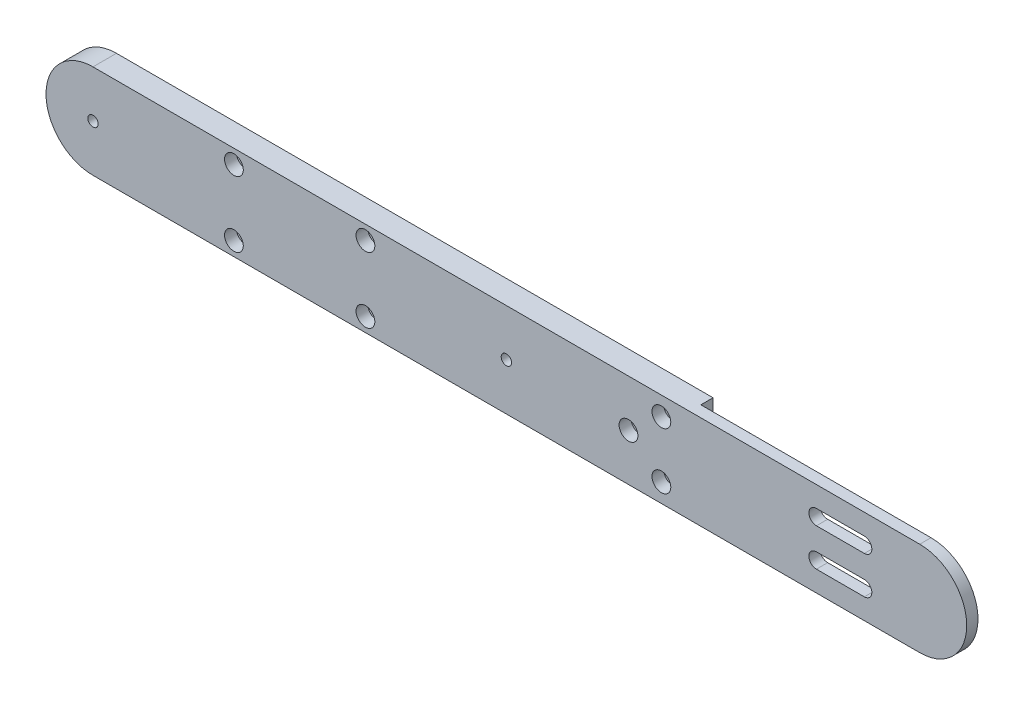
from build123d import *

# Parameters (mm, degrees)
EXTRUDE_1_DEPTH     = 5
SKETCH_1_3_R        = 1.1
CUT_EXTRUDE_2_DEPTH = 187.33571853
SKETCH_1_4_R        = 2.55
CUT_EXTRUDE_3_DEPTH = 2.6
SKETCH_2_R          = 1.25
CUT_EXTRUDE_4_DEPTH = 187.33571853
CUT_EXTRUDE_START   = -5
SKETCH_2_3_R        = 2
CUT_EXTRUDE_5_DEPTH = 2.5
SKETCH_3_W          = 59
SKETCH_3_H          = 2.6
CUT_EXTRUDE_6_DEPTH = 188.138985783
CUT_EXTRUDE_7_DEPTH = 187.33571853


with BuildPart() as part:
    # 草图1 → 凸台-拉伸1 (new body)
    with BuildSketch(Plane.XY):
        with BuildLine():
            Line((0, -10), (176, -10))
            ThreePointArc((176, -10), (186, 0), (176, 10))
            Line((176, 10), (0, 10))
            ThreePointArc((0, 10), (-10, 0), (0, -10))
        make_face()
    extrude(amount=EXTRUDE_1_DEPTH)

    # 草图1<3> → 切除-拉伸2 (cut, through all)
    with BuildSketch(Plane.XY):
        with Locations((88, 0)):
            Circle(SKETCH_1_3_R)
        Circle(SKETCH_1_3_R)
    extrude(amount=CUT_EXTRUDE_2_DEPTH, mode=Mode.SUBTRACT)

    # 草图1<4> → 切除-拉伸3 (cut)
    with BuildSketch(Plane.XY):
        with Locations((88, 0)):
            Circle(SKETCH_1_4_R)
        Circle(SKETCH_1_4_R)
    extrude(amount=CUT_EXTRUDE_3_DEPTH, mode=Mode.SUBTRACT)

    # 草图2 → 切除-拉伸4 (cut, through all)
    with BuildSketch(Plane(origin=(0, 0, 0), x_dir=(-1, 0, 0), z_dir=(0, 0, -1))):
        with Locations((-121, -6)):
            Circle(SKETCH_2_R)
        with Locations((-121, 6)):
            Circle(SKETCH_2_R)
        with Locations((-114, 0)):
            Circle(SKETCH_2_R)
        with Locations((-58, 7)):
            Circle(SKETCH_2_R)
        with Locations((-30, 7)):
            Circle(SKETCH_2_R)
        with Locations((-58, -7)):
            Circle(SKETCH_2_R)
        with Locations((-30, -7)):
            Circle(SKETCH_2_R)
    extrude(amount=-CUT_EXTRUDE_4_DEPTH, mode=Mode.SUBTRACT)

    # 草图2<3> → 切除-拉伸5 (cut)
    with BuildSketch(Plane(origin=(0, 0, 0), x_dir=(-1, 0, 0), z_dir=(0, 0, -1)).offset(CUT_EXTRUDE_START)):
        with Locations(Location((-121, -6, 0), (0, 0, 180))):
            Circle(SKETCH_2_3_R)
        with Locations(Location((-121, 6, 0), (0, 0, 180))):
            Circle(SKETCH_2_3_R)
        with Locations(Location((-114, 0, 0), (0, 0, 180))):
            Circle(SKETCH_2_3_R)
        with Locations(Location((-58, 7, 0), (0, 0, 180))):
            Circle(SKETCH_2_3_R)
        with Locations(Location((-30, 7, 0), (0, 0, 180))):
            Circle(SKETCH_2_3_R)
        with Locations(Location((-58, -7, 0), (0, 0, 180))):
            Circle(SKETCH_2_3_R)
        with Locations(Location((-30, -7, 0), (0, 0, 180))):
            Circle(SKETCH_2_3_R)
    extrude(amount=CUT_EXTRUDE_5_DEPTH, mode=Mode.SUBTRACT)

    # 草图3 → 切除-拉伸6 (cut, through all)
    with BuildSketch(Plane(origin=(0, 10, 0), x_dir=(1, 0, 0), z_dir=(0, 1, 0))):
        with Locations((156.5, -1.3)):
            Rectangle(SKETCH_3_W, SKETCH_3_H)
    extrude(amount=-CUT_EXTRUDE_6_DEPTH, mode=Mode.SUBTRACT)

    # 草图4 → 切除-拉伸7 (cut, through all)
    with BuildSketch(Plane.XY.offset(5)):
        with BuildLine():
            Line((164.2, -2.4), (154, -2.4))
            ThreePointArc((154, -2.4), (152.4, -4), (154, -5.6))
            Line((154, -5.6), (164.2, -5.6))
            ThreePointArc((164.2, -5.6), (165.8, -4), (164.2, -2.4))
        make_face()
        with BuildLine():
            ThreePointArc((154, 5.6), (152.4, 4), (154, 2.4))
            Line((154, 2.4), (164.2, 2.4))
            ThreePointArc((164.2, 2.4), (165.8, 4), (164.2, 5.6))
            Line((164.2, 5.6), (154, 5.6))
        make_face()
    extrude(amount=-CUT_EXTRUDE_7_DEPTH, mode=Mode.SUBTRACT)


solid = part.part
